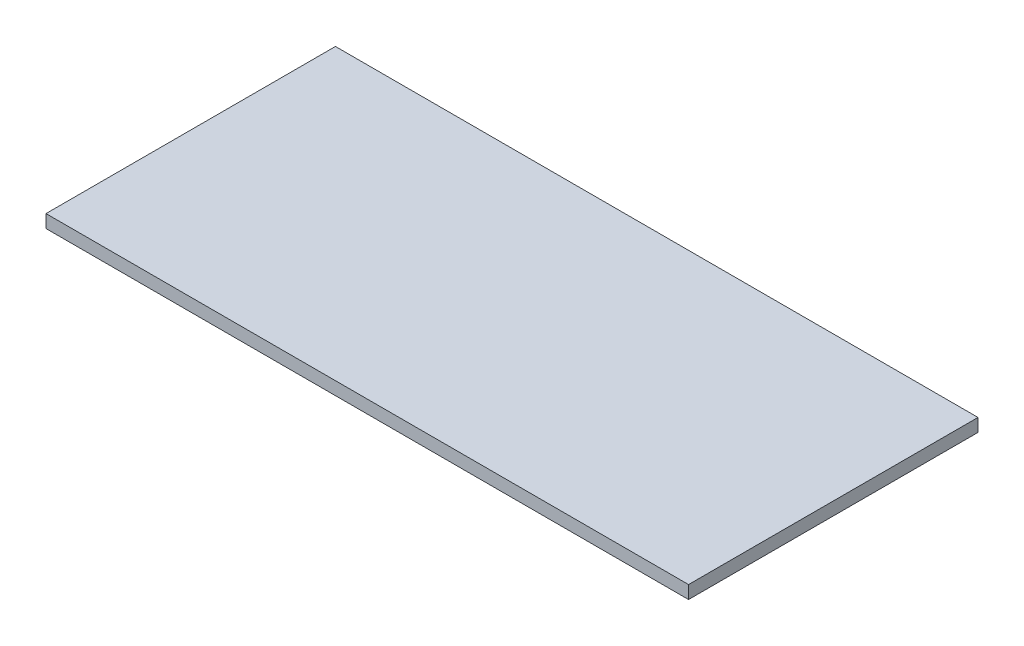
from build123d import *

# Parameters (mm, degrees)
SKETCH1_W           = 490
SKETCH1_H           = 220.726
BOSS_EXTRUDE1_DEPTH = 9.906


with BuildPart() as part:
    # Sketch1 → Boss-Extrude1 (new body)
    with BuildSketch(Plane(origin=(0, 0, 0), x_dir=(1, 0, 0), z_dir=(0, 1, 0))):
        Rectangle(SKETCH1_W, SKETCH1_H)
    extrude(amount=BOSS_EXTRUDE1_DEPTH)


solid = part.part
